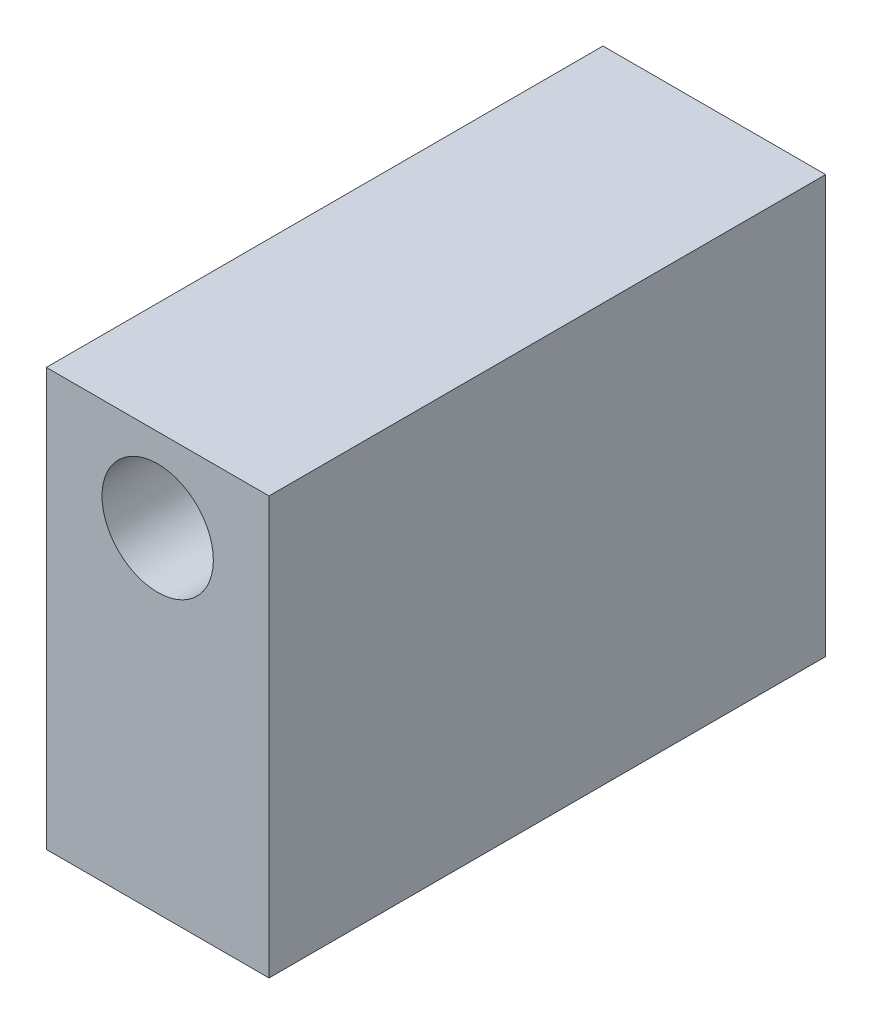
from build123d import *

# Parameters (mm, degrees)
SKETCH1_W               = 40
SKETCH1_H               = 100
BOSS_EXTRUDE1_DEPTH     = 75
CUT_EXTRUDE1_DEPTH      = 50
CUT_EXTRUDE1_DEPTH_BACK = 50
SKETCH2_R               = 10


with BuildPart() as part:
    # Sketch1 → Boss-Extrude1 (new body)
    with BuildSketch(Plane(origin=(0, 0, 0), x_dir=(1, 0, 0), z_dir=(0, 1, 0))):
        Rectangle(SKETCH1_W, SKETCH1_H)
    extrude(amount=BOSS_EXTRUDE1_DEPTH)

    # Sketch2 → Cut-Extrude1 (cut, two sides: drawn at the far end of the back side and taken through both)
    with BuildSketch(Plane.XY.offset(-CUT_EXTRUDE1_DEPTH_BACK)):
        with Locations((0, 60)):
            Circle(SKETCH2_R)
    extrude(amount=CUT_EXTRUDE1_DEPTH + CUT_EXTRUDE1_DEPTH_BACK, mode=Mode.SUBTRACT)


solid = part.part
